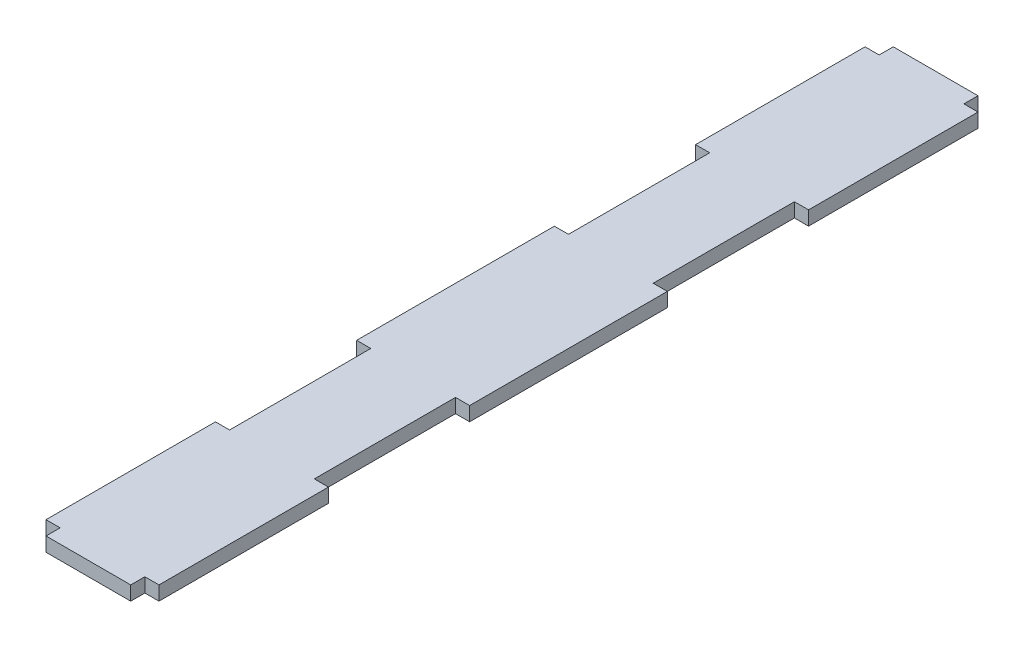
from build123d import *

# Parameters (mm, degrees)
EXTRUDE_1_DEPTH = 5


with BuildPart() as part:
    # 草图1 → 凸台-拉伸1 (new body)
    with BuildSketch(Plane(origin=(0, 0, 0), x_dir=(1, 0, 0), z_dir=(0, 1, 0))):
        Polygon((35, 290), (40, 290), (40, 230), (35, 230), (35, 180), (40, 180), (40, 110), (35, 110), (35, 60), (40, 60), (40, 0), (35, 0), (35, -5), (5, -5), (5, 0), (0, 0), (0, 60), (5, 60), (5, 110), (0, 110), (0, 180), (5, 180), (5, 230), (0, 230), (0, 290), (5, 290), (5, 295), (35, 295), align=None)
    extrude(amount=EXTRUDE_1_DEPTH)


solid = part.part
